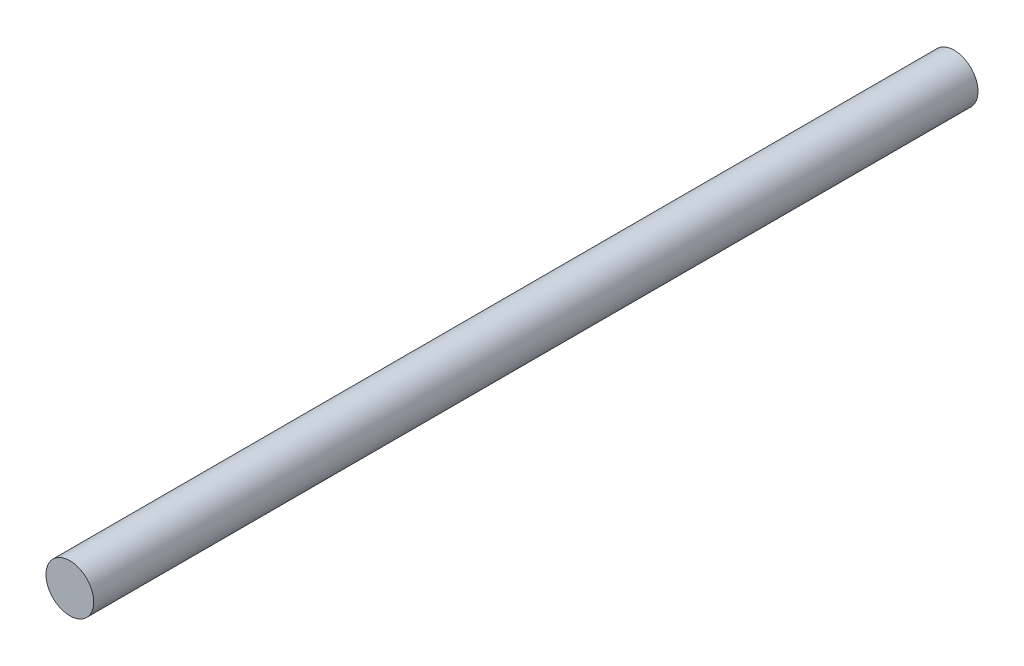
from build123d import *

# Parameters (mm, degrees)
SKETCH1_R             = 2.7
BASE_EXTRUDE_DEPTH    = 100
ESBO_O4_R             = 1.4
CORTE_EXTRUS_O2_DEPTH = 6.5


with BuildPart() as part:
    # Sketch1 → Base-Extrude (new body)
    with BuildSketch(Plane.XY):
        Circle(SKETCH1_R)
    extrude(amount=-BASE_EXTRUDE_DEPTH)

    # Esboço4 → Corte-extrusão2 (cut)
    with BuildSketch(Plane.XY.offset(-100)):
        with Locations(Location((0, 0, 0), (0, 0, 180))):
            Circle(ESBO_O4_R)
    extrude(amount=CORTE_EXTRUS_O2_DEPTH, mode=Mode.SUBTRACT)


solid = part.part
